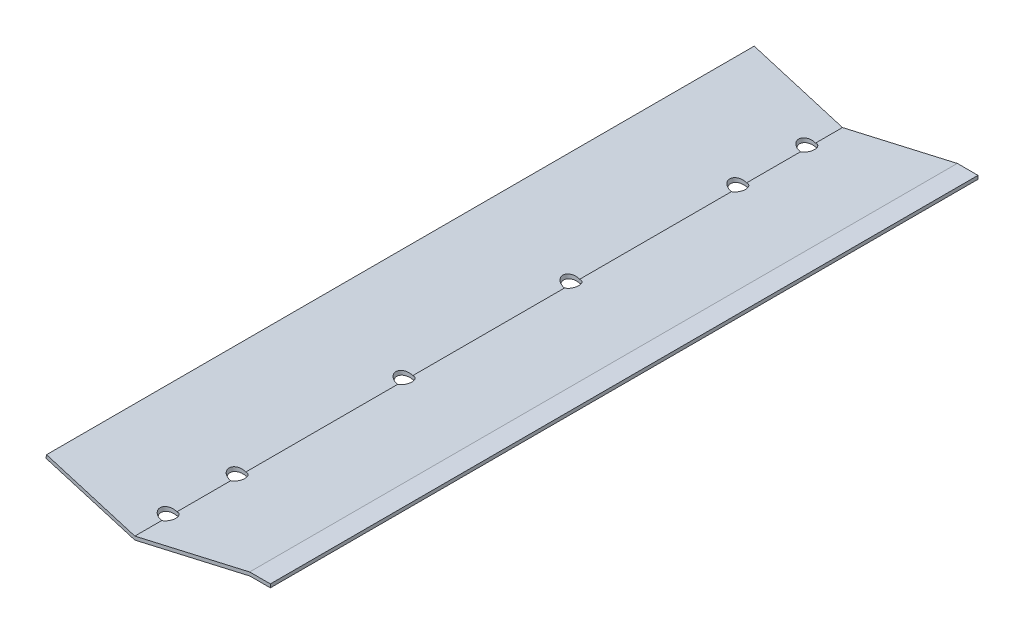
from build123d import *

# Parameters (mm, degrees)
BOSS_EXTRUDE1_DEPTH     = 1026
CUT_EXTRUDE1_DEPTH      = 9844.379832938
CUT_EXTRUDE1_DEPTH_BACK = 9844.379832938
SKETCH2_R               = 11


with BuildPart() as part:
    # Sketch1 → Boss-Extrude1 (new body)
    with BuildSketch(Plane.XY):
        Polygon((-11592.288440525, 7313.590405803), (-11721.096751517, 7351.933229733), (-11720.288440525, 7356.867460508), (-11592.288440525, 7318.657051678), (-11425.788440525, 7356.867460508), (-11395.788440525, 7356.867460508), (-11395.788440525, 7351.867460508), (-11425.381609332, 7351.867460508), align=None)
    extrude(amount=BOSS_EXTRUDE1_DEPTH)

    # Sketch2 → Cut-Extrude1 (cut, two sides: drawn at the far end of the back side and taken through both)
    with BuildSketch(Plane(origin=(-2172.647475249, 9473.814226158, 0), x_dir=(0.9746972479016649, 0.22352913665318996, 0), z_dir=(0.22352913665318996, -0.9746972479016649, 0)).offset(-CUT_EXTRUDE1_DEPTH_BACK)):
        with Locations(Location((-9664.171090618, 50, 0), (0, 0, 275.90955698))):
            Circle(SKETCH2_R)
        with Locations(Location((-9664.171090618, 150, 0), (0, 0, 275.90955698))):
            Circle(SKETCH2_R)
        with Locations(Location((-9664.171090618, 392, 0), (0, 0, 275.90955698))):
            Circle(SKETCH2_R)
        with Locations(Location((-9664.171090618, 876, 0), (0, 0, 275.90955698))):
            Circle(SKETCH2_R)
        with Locations(Location((-9664.171090618, 976, 0), (0, 0, 275.90955698))):
            Circle(SKETCH2_R)
        with Locations(Location((-9664.171090618, 634, 0), (0, 0, 275.90955698))):
            Circle(SKETCH2_R)
    extrude(amount=CUT_EXTRUDE1_DEPTH + CUT_EXTRUDE1_DEPTH_BACK, mode=Mode.SUBTRACT)


solid = part.part
